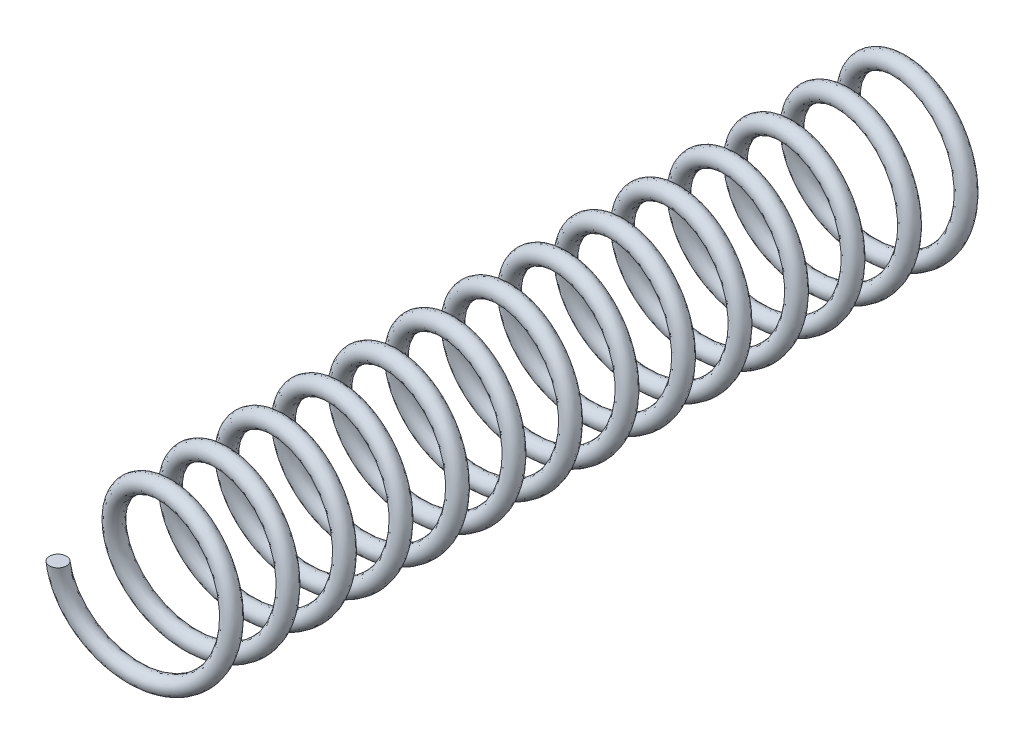
from build123d import *

# Parameters (mm, degrees)
BALAYAGE1_PITCH       = 10
BALAYAGE1_HEIGHT      = 140
BALAYAGE1_RADIUS      = 15
BALAYAGE1_START_ANGLE = -180
ESQUISSE2_R           = 1.5


with BuildPart() as part:
    # Balayage1: sweep along a helix
    with BuildLine() as balayage1_path:
        add(Helix(BALAYAGE1_PITCH, BALAYAGE1_HEIGHT, BALAYAGE1_RADIUS, center=(0, 0, 0), direction=(0, 0, 1), lefthand=True, mode=Mode.PRIVATE).rotate(Axis((0, 0, 0), (0, 0, 1)), BALAYAGE1_START_ANGLE))
    # Esquisse2 → Balayage1 (sweep)
    with BuildSketch(Plane(origin=(0, 0, 0), x_dir=(0, 0, -1), z_dir=(1, 0, 0))):
        with Locations((-140.356170381, -12.802127203)):
            Circle(ESQUISSE2_R)
    sweep(path=balayage1_path.line, is_frenet=True)


solid = part.part
